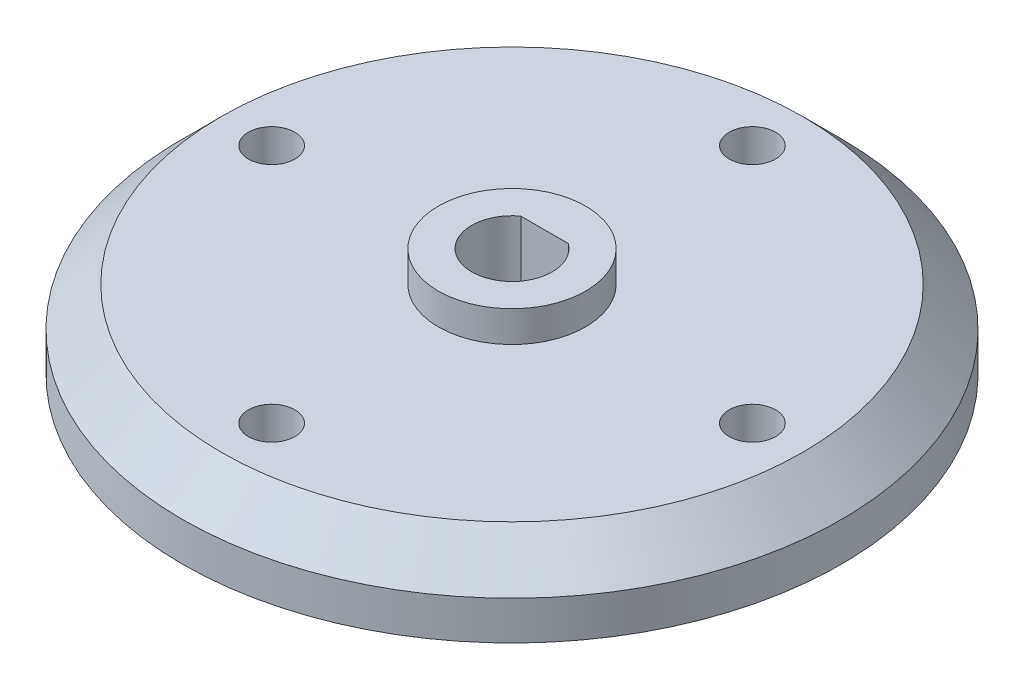
from build123d import *

# Parameters (mm, degrees)
SKETCH1_R           = 21.25
SKETCH1_R_2         = 1.5
BOSS_EXTRUDE1_DEPTH = 5
CHAMFER1_SIZE       = 2.5
SKETCH2_R           = 4.75
BOSS_EXTRUDE2_DEPTH = 2


with BuildPart() as part:
    # Sketch1 → Boss-Extrude1 (new body)
    with BuildSketch(Plane(origin=(0, 0, 0), x_dir=(1, 0, 0), z_dir=(0, 1, 0))):
        with Locations(Location((0, 0, 0), (0, 0, 270))):
            Circle(SKETCH1_R)
        with Locations(Location((0, 15.5, 0), (0, 0, 270))):
            Circle(SKETCH1_R_2, mode=Mode.SUBTRACT)
        with Locations(Location((15.5, 0, 0), (0, 0, 270))):
            Circle(SKETCH1_R_2, mode=Mode.SUBTRACT)
        with Locations(Location((0, -15.5, 0), (0, 0, 270))):
            Circle(SKETCH1_R_2, mode=Mode.SUBTRACT)
        with Locations(Location((-15.5, 0, 0), (0, 0, 270))):
            Circle(SKETCH1_R_2, mode=Mode.SUBTRACT)
        with BuildLine():
            Line((-1.532970972, 2.1), (1.532970972, 2.1))
            ThreePointArc((1.532970972, 2.1), (0, -2.6), (-1.532970972, 2.1))
        make_face(mode=Mode.SUBTRACT)
    extrude(amount=BOSS_EXTRUDE1_DEPTH)

    # Chamfer1
    chamfer1_edges = [part.edges().sort_by_distance(p)[0] for p in [
        (0, 5, -21.25),
    ]]
    chamfer(chamfer1_edges, length=CHAMFER1_SIZE)

    # Sketch2 → Boss-Extrude2 (add)
    with BuildSketch(Plane(origin=(0, 5, 0), x_dir=(1, 0, 0), z_dir=(0, 1, 0))):
        with Locations(Location((0, 0, 0), (0, 0, 270))):
            Circle(SKETCH2_R)
        with BuildLine():
            Line((1.532970972, 2.1), (-1.532970972, 2.1))
            ThreePointArc((-1.532970972, 2.1), (0, -2.6), (1.532970972, 2.1))
        make_face(mode=Mode.SUBTRACT)
    extrude(amount=BOSS_EXTRUDE2_DEPTH)


solid = part.part
